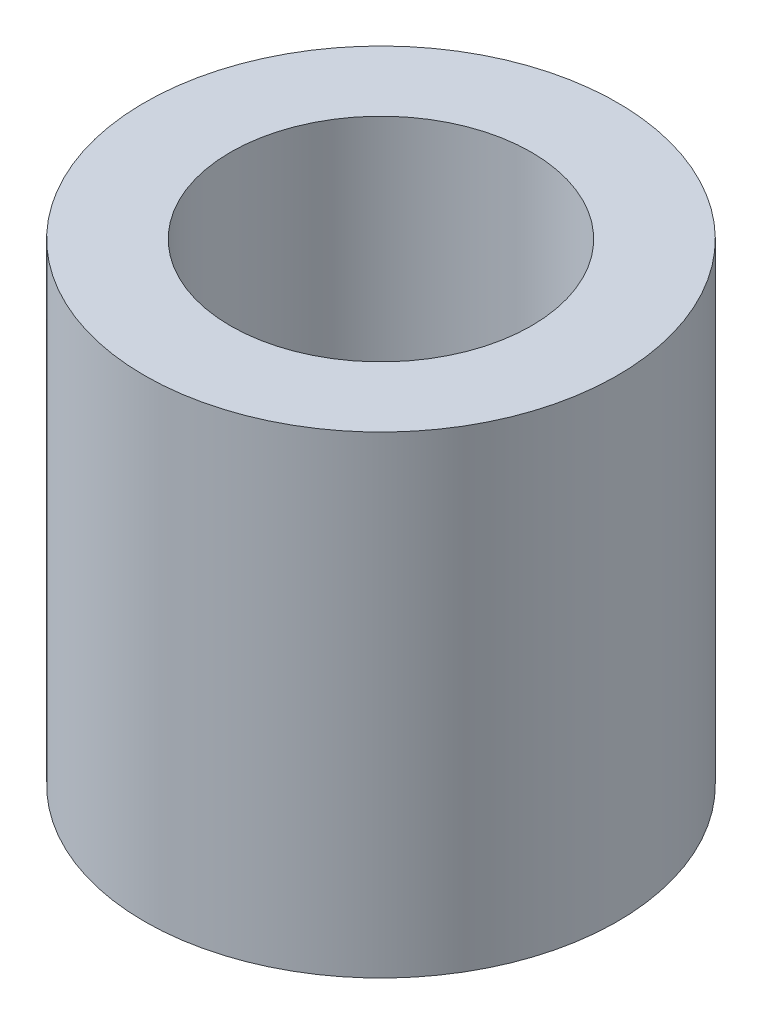
from build123d import *

# Parameters (mm, degrees)
SKETCH1_R                            = 2.75
BOSS_EXTRUDE1_DEPTH                  = 5.5
F_3_5_3_5_DIAMETER_HOLE1_D           = 3.5
F_3_5_3_5_DIAMETER_HOLE1_ON_FACE_2_D = 3.5


with BuildPart() as part:
    # Sketch1 → Boss-Extrude1 (new body)
    with BuildSketch(Plane(origin=(0, 0, 0), x_dir=(1, 0, 0), z_dir=(0, 1, 0))):
        with Locations(Location((0, 0, 0), (0, 0, 270))):
            Circle(SKETCH1_R)
    extrude(amount=BOSS_EXTRUDE1_DEPTH)

    # Ø3.5 (3.5) Diameter Hole1 (through all)
    with Locations(Plane(origin=(0, 0, 0), x_dir=(0, 0, -1), z_dir=(0, -1, 0))):
        with Locations((0, 0)):
            Hole(F_3_5_3_5_DIAMETER_HOLE1_D / 2)

    # Ø3.5 (3.5) Diameter Hole1 on face 2 (through all)
    with Locations(Plane.ZX.offset(5.5)):
        with Locations((0, 0)):
            Hole(F_3_5_3_5_DIAMETER_HOLE1_ON_FACE_2_D / 2)


solid = part.part
